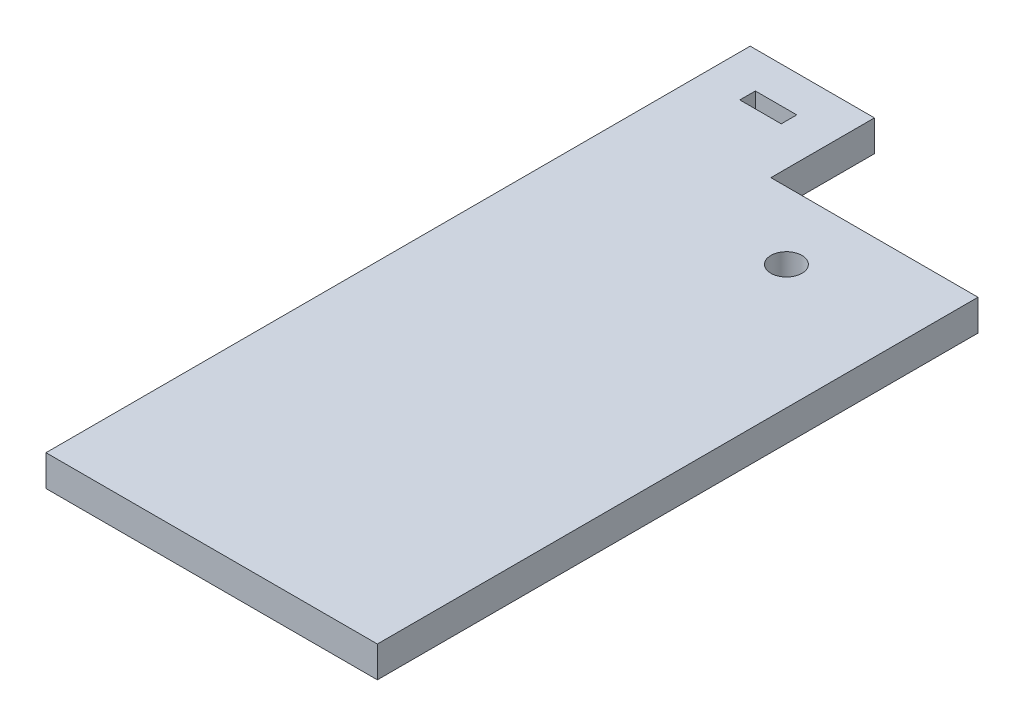
from build123d import *

# Parameters (mm, degrees)
SKETCH1_R           = 1.5
SKETCH1_W           = 4
SKETCH1_H           = 1.5
BOSS_EXTRUDE1_DEPTH = 3
SKETCH3_W           = 12
SKETCH3_H           = 3
CUT_EXTRUDE2_DEPTH  = 82.049367672


with BuildPart() as part:
    # Sketch1 → Boss-Extrude1 (new body)
    with BuildSketch(Plane(origin=(0, 0, 0), x_dir=(1, 0, 0), z_dir=(0, 1, 0))):
        Polygon((0, 58), (0, 68), (12, 68), (12, 58), (44, 58), (44, 0), (0, 0), align=None)
        with Locations(Location((20, 51.5, 0), (0, 0, 270))):
            Circle(SKETCH1_R, mode=Mode.SUBTRACT)
        with Locations(Location((36, 51.5, 0), (0, 0, 270))):
            Circle(SKETCH1_R, mode=Mode.SUBTRACT)
        with Locations((6, 63.75)):
            Rectangle(SKETCH1_W, SKETCH1_H, mode=Mode.SUBTRACT)
    extrude(amount=BOSS_EXTRUDE1_DEPTH)

    # Sketch3 → Cut-Extrude2 (cut, through all)
    with BuildSketch(Plane.XY):
        with Locations((38, 1.5)):
            Rectangle(SKETCH3_W, SKETCH3_H)
    extrude(amount=-CUT_EXTRUDE2_DEPTH, mode=Mode.SUBTRACT)


solid = part.part
